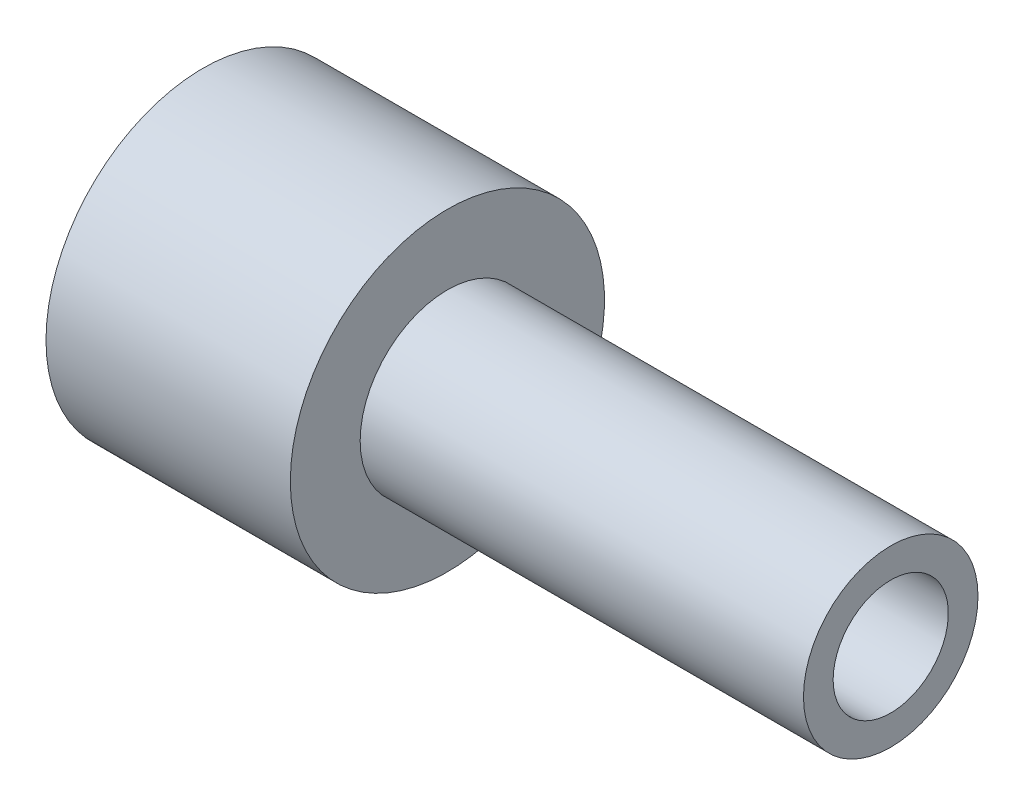
from build123d import *


with BuildPart() as part:
    # Axial profile (mm) → Full revolution (revolve)
    with BuildSketch(Plane.XY, mode=Mode.PRIVATE) as full_revolution_sk:
        Polygon((-6, 1.65), (13.7, 1.65), (13.7, 2.5), (1, 2.5), (1, 4.5), (-6, 4.5), align=None)
    revolve(full_revolution_sk.sketch.rotate(Axis((-110, 0, 0), (1, 0, 0)), 90), axis=Axis((-110, 0, 0), (1, 0, 0)))


solid = part.part
